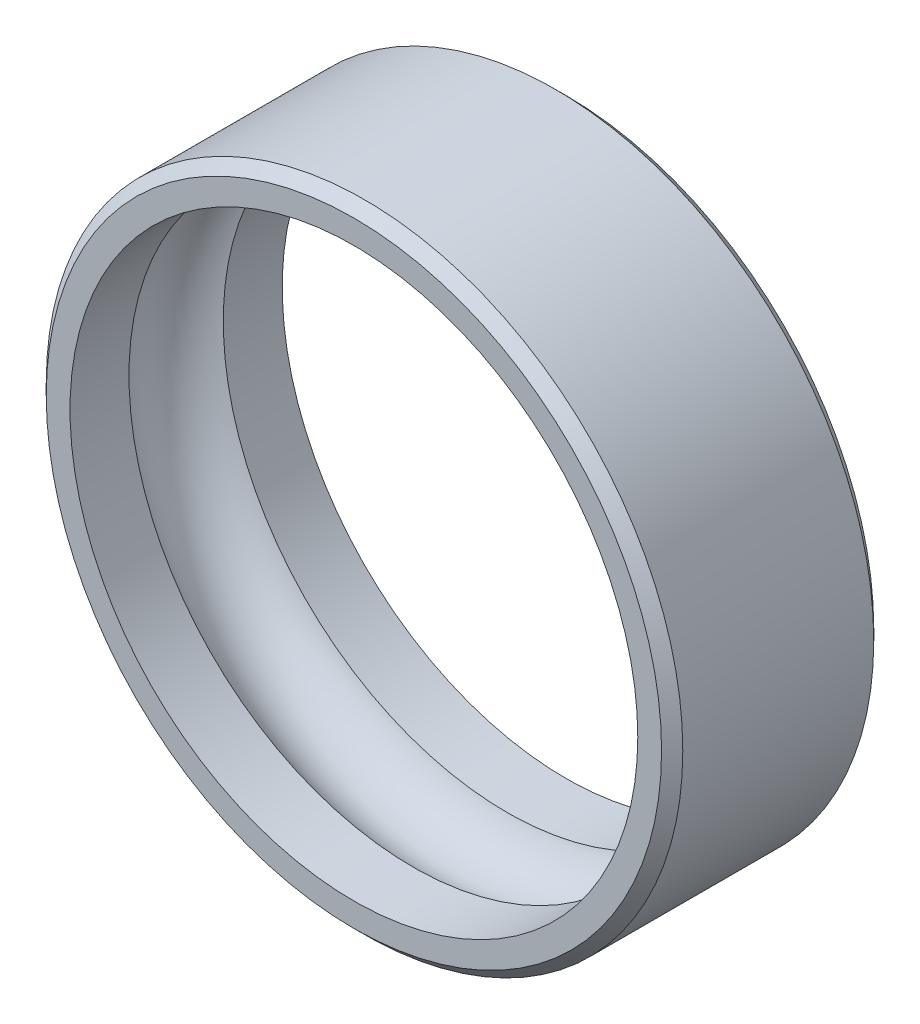
from build123d import *


with BuildPart() as part:
    # Sketch1 → Revolve1 (revolve)
    with BuildSketch(Plane(origin=(0, 0, 0), x_dir=(1, 0, 0), z_dir=(0, 1, 0))):
        with BuildLine():
            Line((4.247870879, 1.5875), (4.247870879, 0.705555556))
            ThreePointArc((4.247870879, 0.705555556), (4.727510244, 0), (4.247870879, -0.705555556))
            Line((4.247870879, -0.705555556), (4.247870879, -1.5875))
            Line((4.247870879, -1.5875), (4.60375, -1.5875))
            Line((4.60375, -1.5875), (4.7625, -1.42875))
            Line((4.7625, -1.42875), (4.7625, 1.42875))
            Line((4.7625, 1.42875), (4.60375, 1.5875))
            Line((4.60375, 1.5875), (4.247870879, 1.5875))
        make_face()
    revolve(axis=Axis((0, 0, -1.5875), (0, 0, 1)))


solid = part.part
